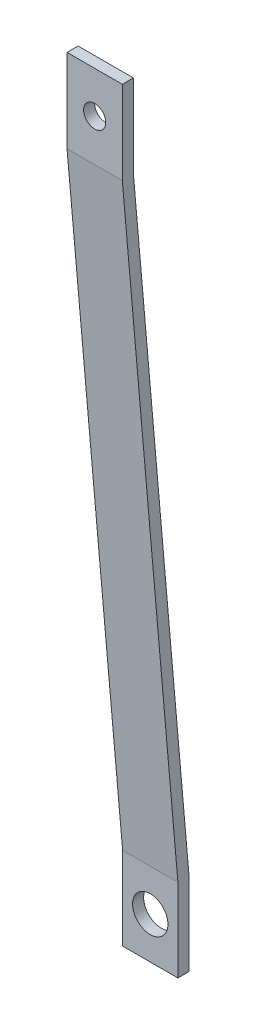
from build123d import *

# Parameters (mm, degrees)
BOSS_EXTRUDE1_DEPTH = 10
SKETCH3_R           = 3.2
CUT_EXTRUDE1_DEPTH  = 2
SKETCH4_R           = 2
CUT_EXTRUDE2_DEPTH  = 2


with BuildPart() as part:
    # Sketch2 → Boss-Extrude1 (new body)
    with BuildSketch(Plane(origin=(0, 0, 0), x_dir=(0, 0, -1), z_dir=(1, 0, 0))):
        Polygon((-10.05355663, 145), (-10.05355663, 130), (0, 15.087321886), (0, 0), (-2, 0), (-2, 15), (-12.05355663, 129.912678114), (-12.05355663, 145), align=None)
    extrude(amount=BOSS_EXTRUDE1_DEPTH)

    # Sketch3 → Cut-Extrude1 (cut)
    with BuildSketch(Plane.XY.offset(2)):
        with Locations((5, 7.5)):
            Circle(SKETCH3_R)
    extrude(amount=-CUT_EXTRUDE1_DEPTH, mode=Mode.SUBTRACT)

    # Sketch4 → Cut-Extrude2 (cut)
    with BuildSketch(Plane.XY.offset(12.05355663)):
        with Locations((5, 137.5)):
            Circle(SKETCH4_R)
    extrude(amount=-CUT_EXTRUDE2_DEPTH, mode=Mode.SUBTRACT)


solid = part.part
